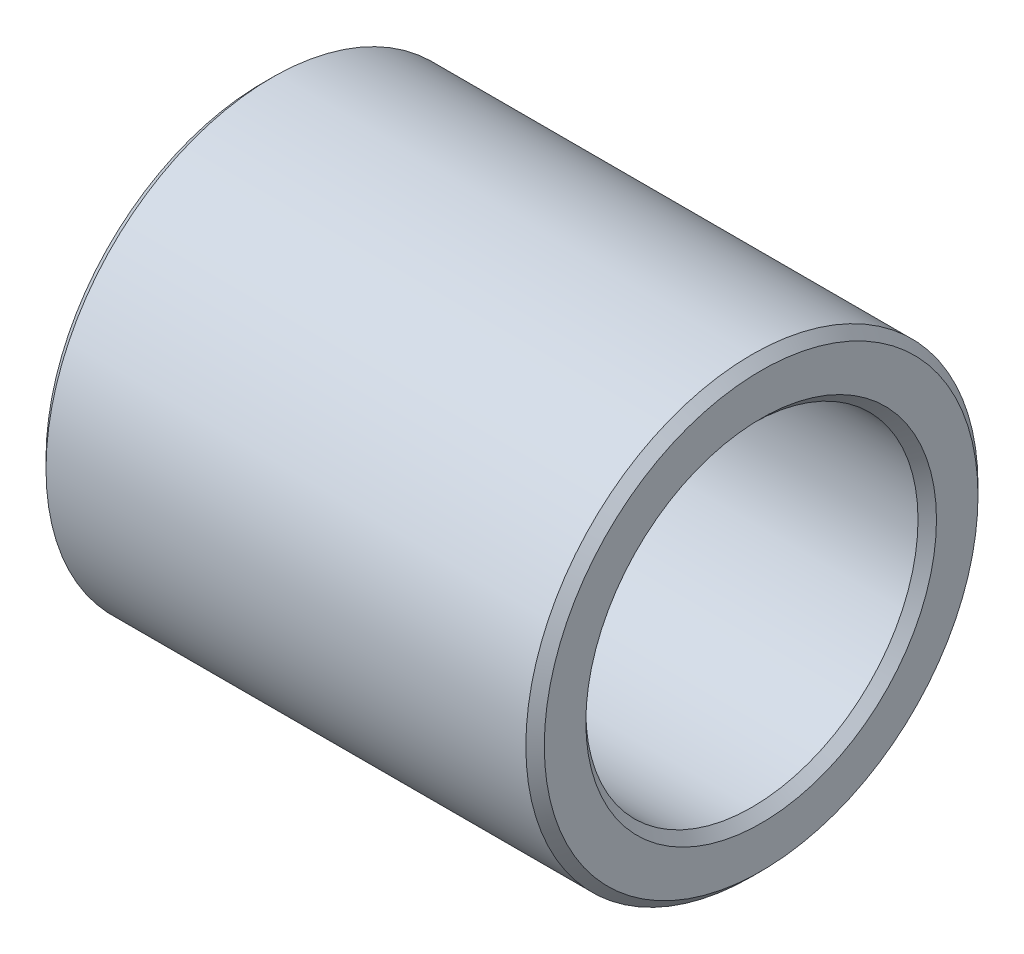
from build123d import *

# Parameters (mm, degrees)
ESQUISSE1_W     = 27
ESQUISSE1_H     = 3.25
CHANFREIN1_SIZE = 0.5


with BuildPart() as part:
    # Esquisse1 → Base-Révol.-Mince (revolve)
    with BuildSketch(Plane.XY, mode=Mode.PRIVATE) as base_r_vol_mince_sk:
        with Locations((0, 10.625)):
            Rectangle(ESQUISSE1_W, ESQUISSE1_H)
    revolve(base_r_vol_mince_sk.sketch.rotate(Axis((0, 0, 0), (1, 0, 0)), 90), axis=Axis((0, 0, 0), (1, 0, 0)))

    # Chanfrein1
    chanfrein1_edges = [part.edges().sort_by_distance(p)[0] for p in [
        (-13.5, 0, -12.25),
        (13.5, 0, -12.25),
        (13.5, 0, -9),
        (-13.5, 0, -9),
    ]]
    chamfer(chanfrein1_edges, length=CHANFREIN1_SIZE)


solid = part.part
